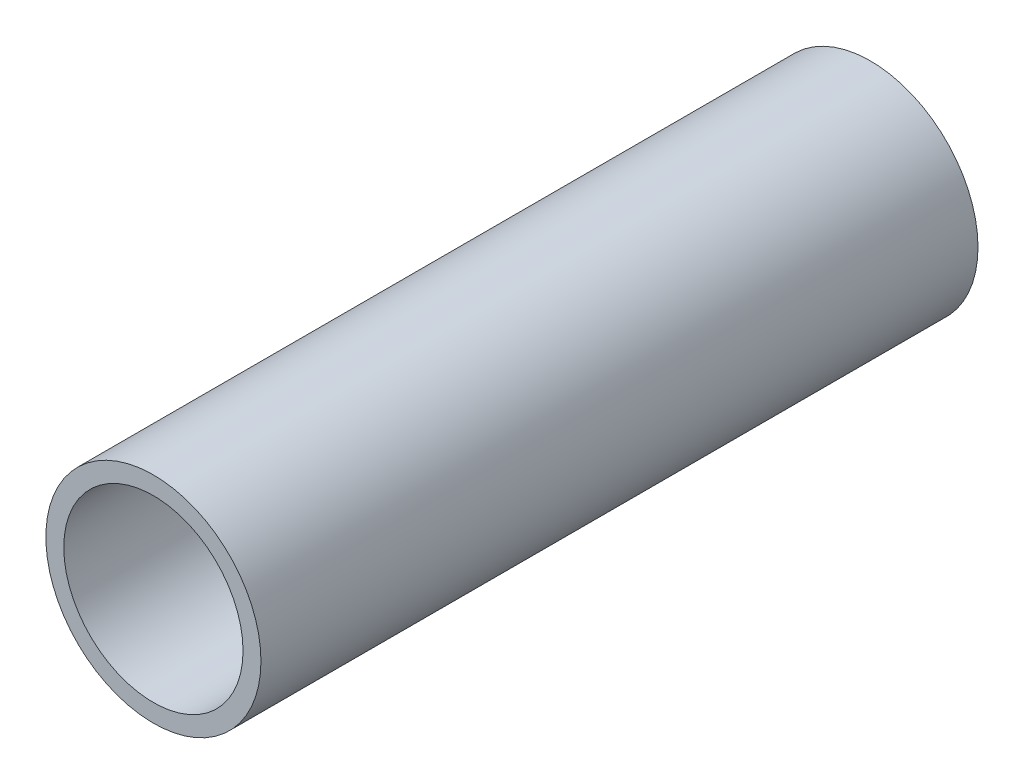
from build123d import *

# Parameters (mm, degrees)
SZKIC1_R                    = 6
SZKIC1_R_2                  = 5
DODANIE_WYCI_GNI_CIE1_DEPTH = 40


with BuildPart() as part:
    # Szkic1 → Dodanie-wyciągnięcie1 (new body)
    with BuildSketch(Plane.XY):
        Circle(SZKIC1_R)
        Circle(SZKIC1_R_2, mode=Mode.SUBTRACT)
    extrude(amount=DODANIE_WYCI_GNI_CIE1_DEPTH)


solid = part.part
